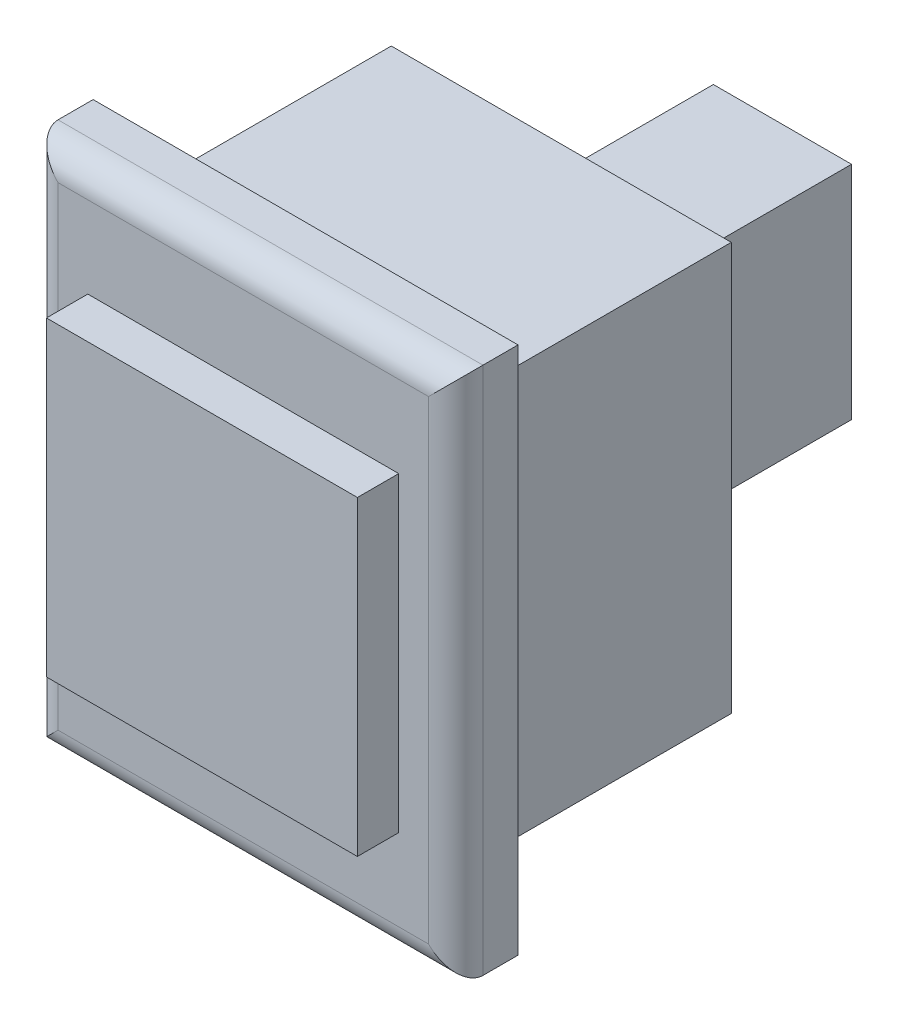
from build123d import *

# Parameters (mm, degrees)
SKETCH1_W           = 15.62
SKETCH1_H           = 19.43
BOSS_EXTRUDE1_DEPTH = 2.29
SKETCH2_W           = 11.43
SKETCH2_H           = 11.43
BOSS_EXTRUDE2_DEPTH = 3.81
FILLET1_R           = 1
SKETCH3_W           = 12.5
SKETCH3_H           = 15
BOSS_EXTRUDE3_DEPTH = 9.4
SKETCH4_W           = 5.08
SKETCH4_H           = 8.13
BOSS_EXTRUDE4_DEPTH = 8.13


with BuildPart() as part:
    # Sketch1 → Boss-Extrude1 (new body)
    with BuildSketch(Plane.XY):
        Rectangle(SKETCH1_W, SKETCH1_H)
    extrude(amount=BOSS_EXTRUDE1_DEPTH)

    # Sketch2 → Boss-Extrude2 (add)
    with BuildSketch(Plane(origin=(0, 0, 0), x_dir=(-1, 0, 0), z_dir=(0, 0, -1))):
        Rectangle(SKETCH2_W, SKETCH2_H)
    extrude(amount=-BOSS_EXTRUDE2_DEPTH)

    # Fillet1
    fillet1_edges = [part.edges().sort_by_distance(p)[0] for p in [
        (-7.81, 0, 2.29),
        (0, -9.715, 2.29),
        (7.81, 0, 2.29),
        (0, 9.715, 2.29),
    ]]
    fillet(fillet1_edges, radius=FILLET1_R)

    # Sketch3 → Boss-Extrude3 (add)
    with BuildSketch(Plane(origin=(0, 0, 0), x_dir=(-1, 0, 0), z_dir=(0, 0, -1))):
        Rectangle(SKETCH3_W, SKETCH3_H)
    extrude(amount=BOSS_EXTRUDE3_DEPTH)

    # Sketch4 → Boss-Extrude4 (add)
    with BuildSketch(Plane(origin=(0, 0, -9.4), x_dir=(-1, 0, 0), z_dir=(0, 0, -1))):
        Rectangle(SKETCH4_W, SKETCH4_H)
    extrude(amount=BOSS_EXTRUDE4_DEPTH)


solid = part.part
